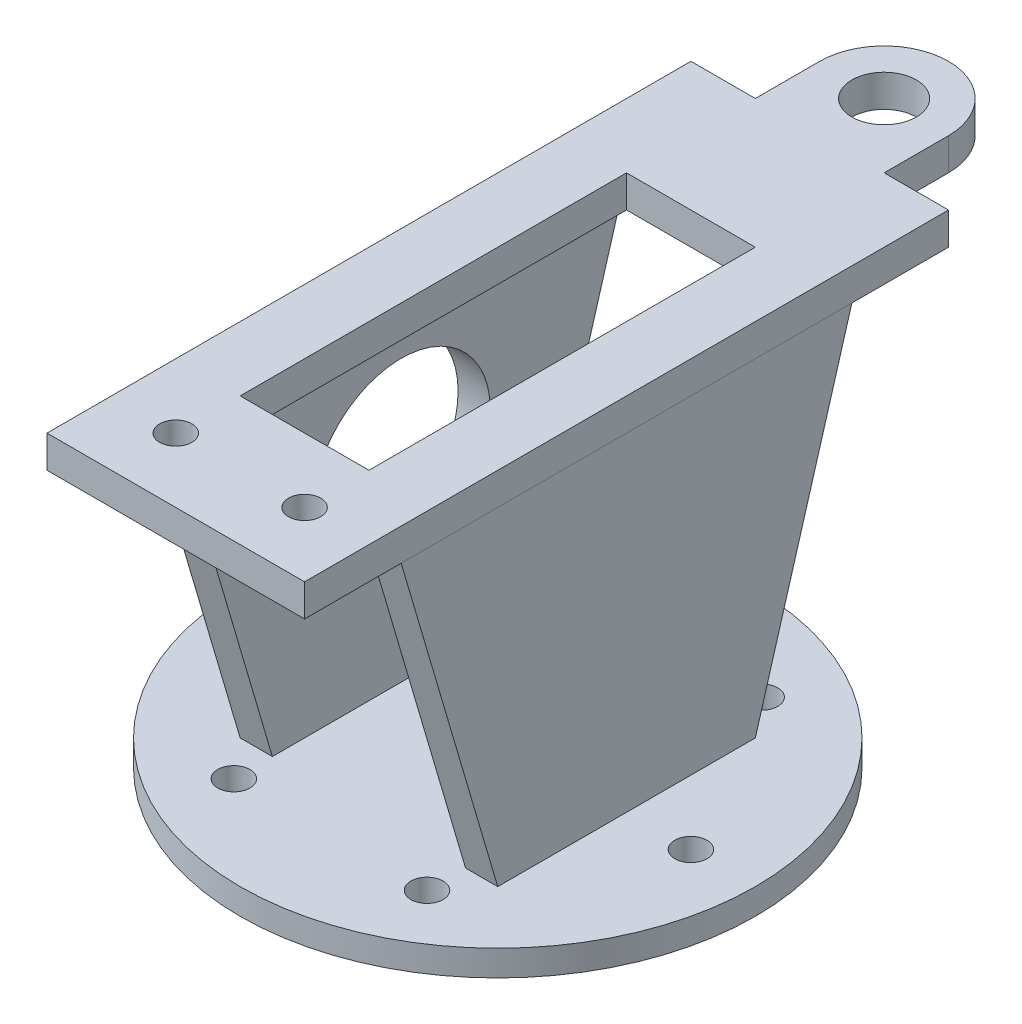
from build123d import *

# Parameters (mm, degrees)
SKETCH1_R      = 50.8
SKETCH1_R_2    = 3.175
EXTRUDE1_DEPTH = 5.08
SKETCH10_R     = 6.35
SKETCH10_R_2   = 3.175
SKETCH10_W     = 25.4
SKETCH10_H     = 76.2
EXTRUDE3_DEPTH = 6.35
SKETCH16_R     = 17.583801549
EXTRUDE4_DEPTH = 6.35
EXTRUDE5_DEPTH = 6.35


with BuildPart() as part:
    # Sketch1 → Extrude1 (new body)
    with BuildSketch(Plane(origin=(0, 0, 0), x_dir=(1, 0, 0), z_dir=(0, 1, 0))):
        Circle(SKETCH1_R)
        with Locations((38.1, 0)):
            Circle(SKETCH1_R_2, mode=Mode.SUBTRACT)
        with Locations((19.05, -32.995567884)):
            Circle(SKETCH1_R_2, mode=Mode.SUBTRACT)
        with Locations((-19.05, -32.995567884)):
            Circle(SKETCH1_R_2, mode=Mode.SUBTRACT)
        with Locations((-38.1, 0)):
            Circle(SKETCH1_R_2, mode=Mode.SUBTRACT)
        with Locations((-19.05, 32.995567884)):
            Circle(SKETCH1_R_2, mode=Mode.SUBTRACT)
        with Locations((19.05, 32.995567884)):
            Circle(SKETCH1_R_2, mode=Mode.SUBTRACT)
    extrude(amount=EXTRUDE1_DEPTH)


with BuildPart() as body_2:
    # Sketch10 → Extrude3 (new body)
    with BuildSketch(Plane(origin=(0, 69.85, 0), x_dir=(1, 0, 0), z_dir=(0, 1, 0))):
        with BuildLine():
            Line((-12.7, 63.5), (-25.4, 63.5))
            Line((-25.4, 63.5), (-25.4, -63.5))
            Line((-25.4, -63.5), (25.4, -63.5))
            Line((25.4, -63.5), (25.4, 63.5))
            Line((25.4, 63.5), (12.7, 63.5))
            Line((12.7, 63.5), (12.7, 76.2))
            ThreePointArc((12.7, 76.2), (0, 88.9), (-12.7, 76.2))
            Line((-12.7, 76.2), (-12.7, 63.5))
        make_face()
        with Locations((0, 76.2)):
            Circle(SKETCH10_R, mode=Mode.SUBTRACT)
        with Locations((-12.7, -50.8)):
            Circle(SKETCH10_R_2, mode=Mode.SUBTRACT)
        with Locations((12.7, -50.8)):
            Circle(SKETCH10_R_2, mode=Mode.SUBTRACT)
        Rectangle(SKETCH10_W, SKETCH10_H, mode=Mode.SUBTRACT)
    extrude(amount=EXTRUDE3_DEPTH)


with BuildPart() as body_3:
    # Sketch16 → Extrude4 (new body)
    with BuildSketch(Plane(origin=(-25.4, 0, 0), x_dir=(0, 0, -1), z_dir=(1, 0, 0))):
        Polygon((0, 5.08), (25.4, 5.08), (44.45, 69.85), (-44.45, 69.85), (-25.4, 5.08), align=None)
        with Locations((0, 42.811356357)):
            Circle(SKETCH16_R, mode=Mode.SUBTRACT)
    extrude(amount=EXTRUDE4_DEPTH)


with BuildPart() as body_4:
    # Sketch11 → Extrude5 (new body)
    with BuildSketch(Plane(origin=(25.4, 0, 0), x_dir=(0, 0, -1), z_dir=(1, 0, 0))):
        Polygon((0, 5.08), (25.4, 5.08), (44.45, 69.85), (-44.45, 69.85), (-25.4, 5.08), align=None)
    extrude(amount=-EXTRUDE5_DEPTH)


solid = Compound([part.part, body_2.part, body_3.part, body_4.part])
